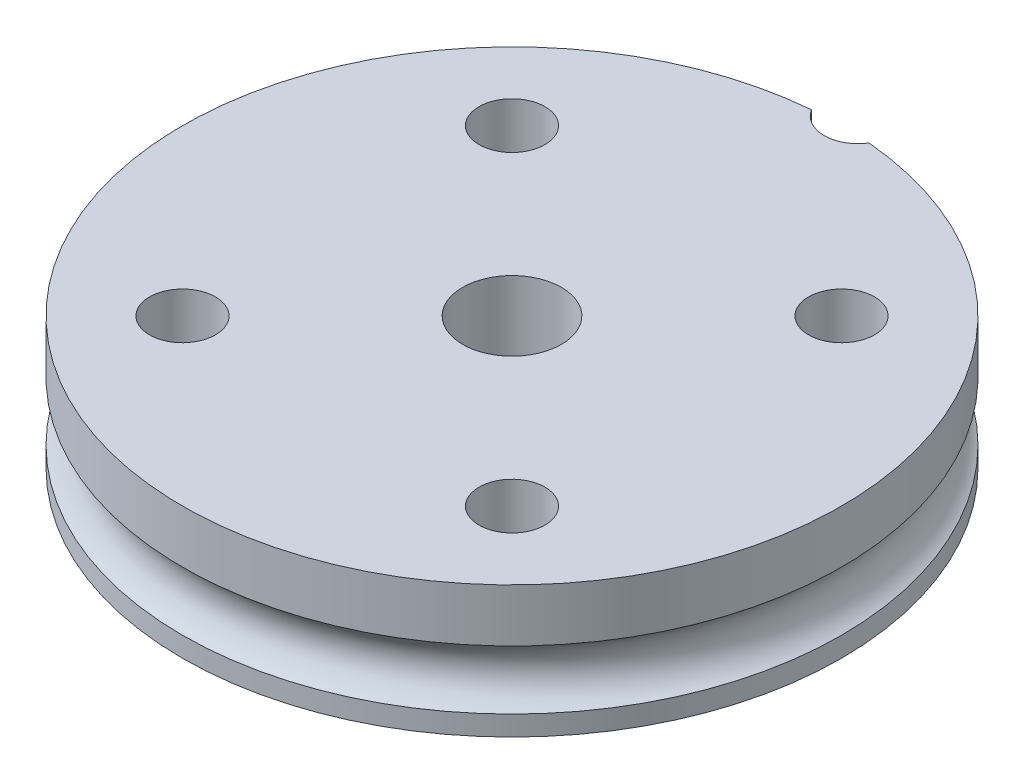
from build123d import *

# Parameters (mm, degrees)
CUT_EXTRUDE_1_DEPTH = 2.5
CUT_EXTRUDE_2_DEPTH = 3
CUT_EXTRUDE_4_DEPTH = 29.722813233
SKETCH_8_R          = 2.05
CUT_EXTRUDE_6_DEPTH = 5


with BuildPart() as part:
    # 草图2 → 旋转1 (revolve)
    with BuildSketch(Plane.XY, mode=Mode.PRIVATE) as revolve_1_sk:
        with BuildLine():
            Line((3, 8), (3, 0))
            Line((3, 0), (20, 0))
            Line((20, 0), (20, 1.210446983))
            ThreePointArc((20, 1.210446983), (18.95, 3), (20, 4.789553017))
            Line((20, 4.789553017), (20, 8))
            Line((20, 8), (3, 8))
        make_face()
    revolve(revolve_1_sk.sketch.rotate(Axis((0, 0, 0), (0, 1, 0)), 90), axis=Axis((0, 0, 0), (0, 1, 0)))

    # 草图3 → 切除-拉伸1 (cut)
    with BuildSketch(Plane.XZ):
        with BuildLine():
            Line((1.835992055, -17.350058041), (3.408354199, -10.798521635))
            ThreePointArc((3.408354199, -10.798521635), (6.061153739, -6.061181984), (10.798487471, -3.408371874))
            Line((10.798487471, -3.408371874), (17.350061912, -1.835985141))
            ThreePointArc((17.350061912, -1.835985141), (18.129967792, -1.363900547), (18.492480347, -0.527418811))
            Line((18.492480347, -0.527418811), (18.492480347, 0.527418811))
            ThreePointArc((18.492480347, 0.527418811), (18.129968102, 1.363905618), (17.350058041, 1.835992055))
            Line((17.350058041, 1.835992055), (10.798521635, 3.408354199))
            ThreePointArc((10.798521635, 3.408354199), (6.061181984, 6.061153739), (3.408371874, 10.798487471))
            Line((3.408371874, 10.798487471), (1.835985141, 17.350061912))
            ThreePointArc((1.835985141, 17.350061912), (1.363900547, 18.129967792), (0.527418811, 18.492480347))
            Line((0.527418811, 18.492480347), (-0.527418811, 18.492480347))
            ThreePointArc((-0.527418811, 18.492480347), (-1.363905618, 18.129968102), (-1.835992055, 17.350058041))
            Line((-1.835992055, 17.350058041), (-3.408354199, 10.798521635))
            ThreePointArc((-3.408354199, 10.798521635), (-6.061153739, 6.061181984), (-10.798487471, 3.408371874))
            Line((-10.798487471, 3.408371874), (-17.350061912, 1.835985141))
            ThreePointArc((-17.350061912, 1.835985141), (-18.129967792, 1.363900547), (-18.492480347, 0.527418811))
            Line((-18.492480347, 0.527418811), (-18.492480347, -0.527418811))
            ThreePointArc((-18.492480347, -0.527418811), (-18.129968102, -1.363905618), (-17.350058041, -1.835992055))
            Line((-17.350058041, -1.835992055), (-10.798521635, -3.408354199))
            ThreePointArc((-10.798521635, -3.408354199), (-6.061181984, -6.061153739), (-3.408371874, -10.798487471))
            Line((-3.408371874, -10.798487471), (-1.835985141, -17.350061912))
            ThreePointArc((-1.835985141, -17.350061912), (-1.363900547, -18.129967792), (-0.527418811, -18.492480347))
            Line((-0.527418811, -18.492480347), (0.527418811, -18.492480347))
            ThreePointArc((0.527418811, -18.492480347), (1.363905618, -18.129968102), (1.835992055, -17.350058041))
        make_face()
    extrude(amount=-CUT_EXTRUDE_1_DEPTH, mode=Mode.SUBTRACT)

    # 草图4 → 切除-拉伸2 (cut)
    with BuildSketch(Plane.XZ):
        Polygon((13.485234102, 9.96339746), (11.810918321, 12.86339746), (8.46228676, 12.86339746), (6.787970979, 9.96339746), (8.46228676, 7.06339746), (11.810918321, 7.06339746), align=None)
        Polygon((-10, 13.348631561), (-12.9, 11.674315781), (-12.9, 8.325684219), (-10, 6.651368439), (-7.1, 8.325684219), (-7.1, 11.674315781), align=None)
        Polygon((10.1, -13.521836642), (13, -11.847520861), (13, -8.4988893), (10.1, -6.824573519), (7.2, -8.4988893), (7.2, -11.847520861), align=None)
        Polygon((-13.385234102, -10.13660254), (-11.710918321, -13.03660254), (-8.36228676, -13.03660254), (-6.687970979, -10.13660254), (-8.36228676, -7.23660254), (-11.710918321, -7.23660254), align=None)
    extrude(amount=-CUT_EXTRUDE_2_DEPTH, mode=Mode.SUBTRACT)

    # 草图6 → 切除-拉伸4 (cut, through all)
    with BuildSketch(Plane.XZ.offset(-3)):
        with BuildLine():
            Line((-10, -8), (-10, -10))
            Line((-10, -10), (-8, -10))
            ThreePointArc((-8, -10), (-8.585786438, -8.585786438), (-10, -8))
        make_face()
        with BuildLine():
            Line((-8, -10), (-10, -10))
            Line((-10, -10), (-10, -8))
            ThreePointArc((-10, -8), (-11.414213562, -11.414213562), (-8, -10))
        make_face()
        with BuildLine():
            ThreePointArc((-8, 10), (-11.414213562, 11.414213562), (-10, 8))
            Line((-10, 8), (-10, 10))
            Line((-10, 10), (-8, 10))
        make_face()
        with BuildLine():
            Line((-10, 10), (-10, 8))
            ThreePointArc((-10, 8), (-8.585786438, 8.585786438), (-8, 10))
            Line((-8, 10), (-10, 10))
        make_face()
        with BuildLine():
            ThreePointArc((8, 10), (8.585786438, 8.585786438), (10, 8))
            Line((10, 8), (10, 10))
            Line((10, 10), (8, 10))
        make_face()
        with BuildLine():
            Line((10, 10), (10, 8))
            ThreePointArc((10, 8), (11.414213562, 8.585786438), (12, 10))
            ThreePointArc((12, 10), (10, 12), (8, 10))
            Line((8, 10), (10, 10))
        make_face()
        with BuildLine():
            ThreePointArc((10, -8), (8.585786438, -8.585786438), (8, -10))
            Line((8, -10), (10, -10))
            Line((10, -10), (10, -8))
        make_face()
        with BuildLine():
            Line((10, -10), (8, -10))
            ThreePointArc((8, -10), (10, -12), (12, -10))
            ThreePointArc((12, -10), (11.414213562, -8.585786438), (10, -8))
            Line((10, -8), (10, -10))
        make_face()
    extrude(amount=-CUT_EXTRUDE_4_DEPTH, mode=Mode.SUBTRACT)

    # 草图8 → 切除-拉伸6 (cut)
    with BuildSketch(Plane(origin=(0, 8, 0), x_dir=(1, 0, 0), z_dir=(0, 1, 0))):
        with Locations((0, 21)):
            Circle(SKETCH_8_R)
    extrude(amount=-CUT_EXTRUDE_6_DEPTH, mode=Mode.SUBTRACT)


solid = part.part
